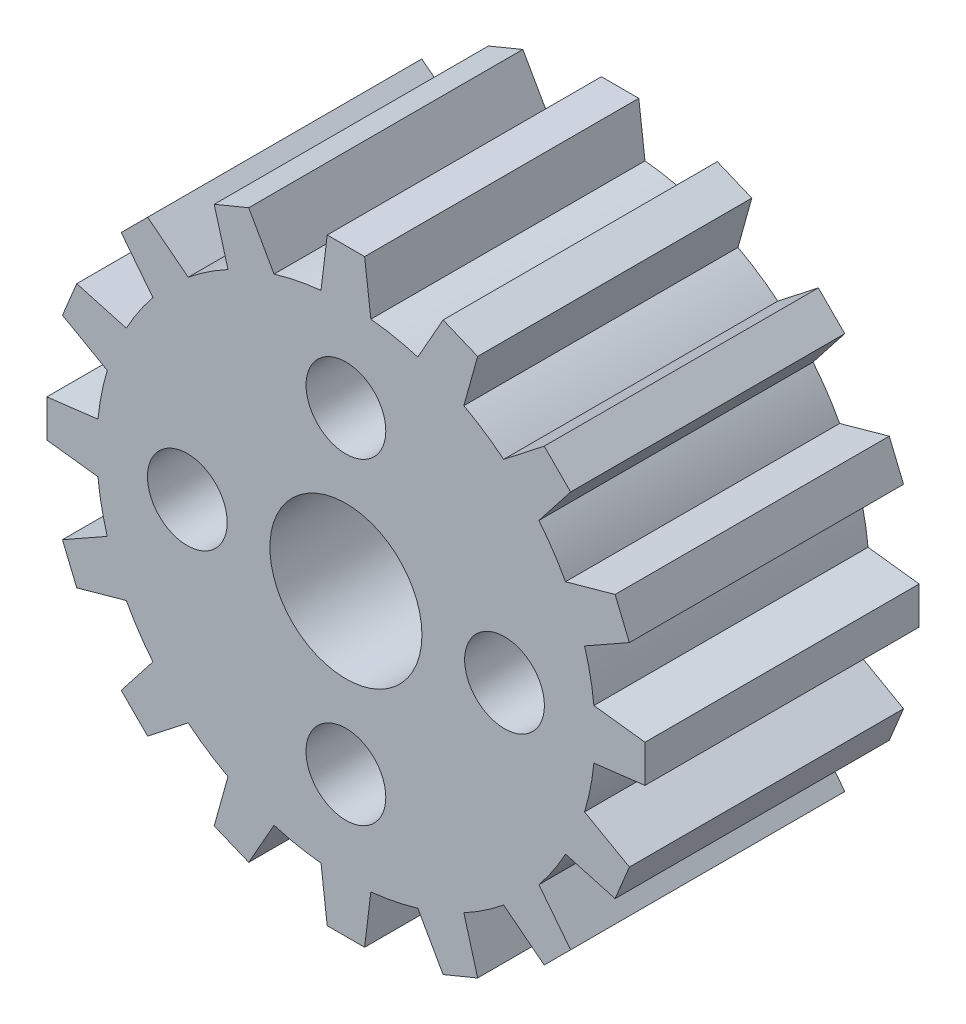
from build123d import *

# Parameters (mm, degrees)
SKETCH_1_R          = 1.6
SKETCH_1_R_2        = 3.05
EXTRUDE_1_DEPTH     = 11
SKETCH_2_R          = 1.65
CUT_EXTRUDE_3_DEPTH = 21.223748416


with BuildPart() as part:
    # ｽｹｯﾁ1 → ﾎﾞｽ - 押し出し1 (new body)
    with BuildSketch(Plane.XY):
        with BuildLine():
            Line((-0.75, 12), (-1, 9.949874371))
            ThreePointArc((-1, 9.949874371), (-1.95090322, 9.807852804), (-2.883772543, 9.575168715))
            Line((-2.883772543, 9.575168715), (-3.899291539, 11.373566964))
            Line((-3.899291539, 11.373566964), (-5.285110838, 10.799541816))
            Line((-5.285110838, 10.799541816), (-4.731531608, 8.80980185))
            ThreePointArc((-4.731531608, 8.80980185), (-5.55570233, 8.314696123), (-6.328516859, 7.742730421))
            Line((-6.328516859, 7.742730421), (-7.954951288, 9.01561146))
            Line((-7.954951288, 9.01561146), (-9.01561146, 7.954951288))
            Line((-9.01561146, 7.954951288), (-7.742730421, 6.328516859))
            ThreePointArc((-7.742730421, 6.328516859), (-8.314696123, 5.55570233), (-8.80980185, 4.731531608))
            Line((-8.80980185, 4.731531608), (-10.799541816, 5.285110838))
            Line((-10.799541816, 5.285110838), (-11.373566964, 3.899291539))
            Line((-11.373566964, 3.899291539), (-9.575168715, 2.883772543))
            ThreePointArc((-9.575168715, 2.883772543), (-9.807852804, 1.95090322), (-9.949874371, 1))
            Line((-9.949874371, 1), (-12, 0.75))
            Line((-12, 0.75), (-12, -0.75))
            Line((-12, -0.75), (-9.949874371, -1))
            ThreePointArc((-9.949874371, -1), (-9.807852804, -1.95090322), (-9.575168715, -2.883772543))
            Line((-9.575168715, -2.883772543), (-11.373566964, -3.899291539))
            Line((-11.373566964, -3.899291539), (-10.799541816, -5.285110838))
            Line((-10.799541816, -5.285110838), (-8.80980185, -4.731531608))
            ThreePointArc((-8.80980185, -4.731531608), (-8.314696123, -5.55570233), (-7.742730421, -6.328516859))
            Line((-7.742730421, -6.328516859), (-9.01561146, -7.954951288))
            Line((-9.01561146, -7.954951288), (-7.954951288, -9.01561146))
            Line((-7.954951288, -9.01561146), (-6.328516859, -7.742730421))
            ThreePointArc((-6.328516859, -7.742730421), (-5.55570233, -8.314696123), (-4.731531608, -8.80980185))
            Line((-4.731531608, -8.80980185), (-5.285110838, -10.799541816))
            Line((-5.285110838, -10.799541816), (-3.899291539, -11.373566964))
            Line((-3.899291539, -11.373566964), (-2.883772543, -9.575168715))
            ThreePointArc((-2.883772543, -9.575168715), (-1.95090322, -9.807852804), (-1, -9.949874371))
            Line((-1, -9.949874371), (-0.75, -12))
            Line((-0.75, -12), (0.75, -12))
            Line((0.75, -12), (1, -9.949874371))
            ThreePointArc((1, -9.949874371), (1.95090322, -9.807852804), (2.883772543, -9.575168715))
            Line((2.883772543, -9.575168715), (3.899291539, -11.373566964))
            Line((3.899291539, -11.373566964), (5.285110838, -10.799541816))
            Line((5.285110838, -10.799541816), (4.731531608, -8.80980185))
            ThreePointArc((4.731531608, -8.80980185), (5.55570233, -8.314696123), (6.328516859, -7.742730421))
            Line((6.328516859, -7.742730421), (7.954951288, -9.01561146))
            Line((7.954951288, -9.01561146), (9.01561146, -7.954951288))
            Line((9.01561146, -7.954951288), (7.742730421, -6.328516859))
            ThreePointArc((7.742730421, -6.328516859), (8.314696123, -5.55570233), (8.80980185, -4.731531608))
            Line((8.80980185, -4.731531608), (10.799541816, -5.285110838))
            Line((10.799541816, -5.285110838), (11.373566964, -3.899291539))
            Line((11.373566964, -3.899291539), (9.575168715, -2.883772543))
            ThreePointArc((9.575168715, -2.883772543), (9.807852804, -1.95090322), (9.949874371, -1))
            Line((9.949874371, -1), (12, -0.75))
            Line((12, -0.75), (12, 0.75))
            Line((12, 0.75), (9.949874371, 1))
            ThreePointArc((9.949874371, 1), (9.807852804, 1.95090322), (9.575168715, 2.883772543))
            Line((9.575168715, 2.883772543), (11.373566964, 3.899291539))
            Line((11.373566964, 3.899291539), (10.799541816, 5.285110838))
            Line((10.799541816, 5.285110838), (8.80980185, 4.731531608))
            ThreePointArc((8.80980185, 4.731531608), (8.314696123, 5.55570233), (7.742730421, 6.328516859))
            Line((7.742730421, 6.328516859), (9.01561146, 7.954951288))
            Line((9.01561146, 7.954951288), (7.954951288, 9.01561146))
            Line((7.954951288, 9.01561146), (6.328516859, 7.742730421))
            ThreePointArc((6.328516859, 7.742730421), (5.55570233, 8.314696123), (4.731531608, 8.80980185))
            Line((4.731531608, 8.80980185), (5.285110838, 10.799541816))
            Line((5.285110838, 10.799541816), (3.899291539, 11.373566964))
            Line((3.899291539, 11.373566964), (2.883772543, 9.575168715))
            ThreePointArc((2.883772543, 9.575168715), (1.95090322, 9.807852804), (1, 9.949874371))
            Line((1, 9.949874371), (0.75, 12))
            Line((0.75, 12), (-0.75, 12))
        make_face()
        with Locations((0, 6.363961031)):
            Circle(SKETCH_1_R, mode=Mode.SUBTRACT)
        with Locations((0, -6.363961031)):
            Circle(SKETCH_1_R, mode=Mode.SUBTRACT)
        with Locations((-6.363961031, 0)):
            Circle(SKETCH_1_R, mode=Mode.SUBTRACT)
        Circle(SKETCH_1_R_2, mode=Mode.SUBTRACT)
        with Locations((6.363961031, 0)):
            Circle(SKETCH_1_R, mode=Mode.SUBTRACT)
    extrude(amount=EXTRUDE_1_DEPTH)

    # ｽｹｯﾁ2 → ｶｯﾄ - 押し出し3 (cut, through all)
    with BuildSketch(Plane(origin=(0, 0, 0), x_dir=(0, 0, -1), z_dir=(0.8314696123025446, -0.5555702330196034, 0))):
        with Locations((-5.5, 0)):
            Circle(SKETCH_2_R)
    extrude(amount=-CUT_EXTRUDE_3_DEPTH, mode=Mode.SUBTRACT)


solid = part.part
